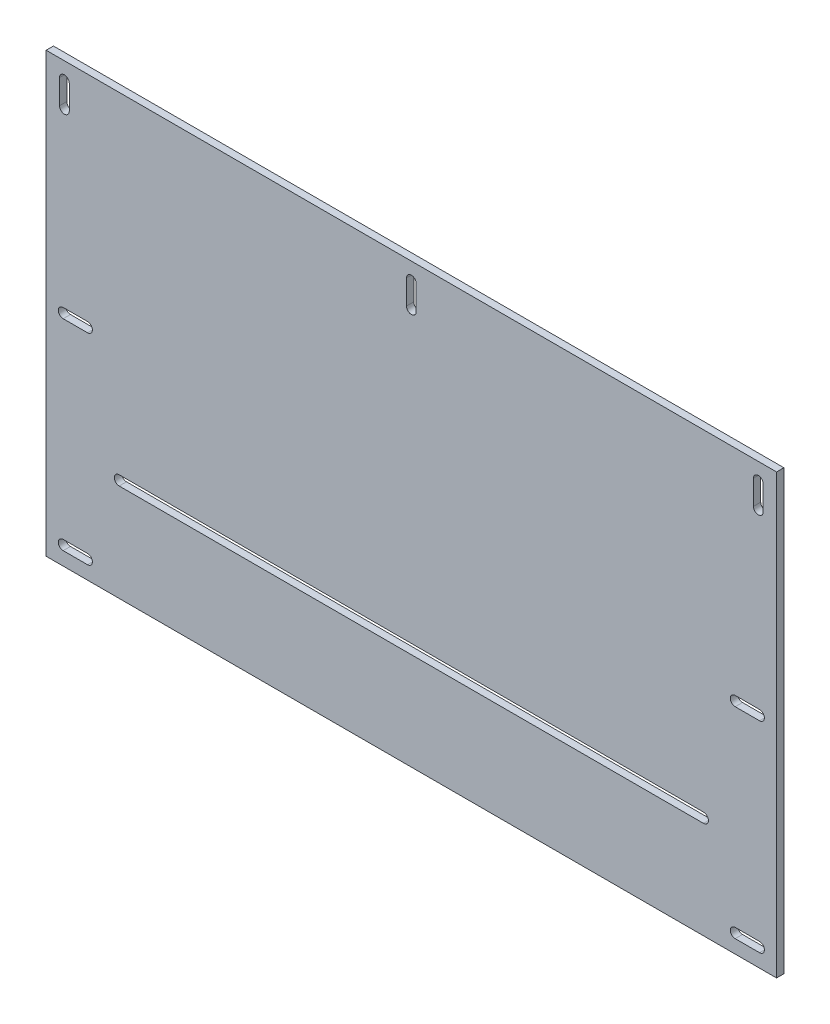
from build123d import *

# Parameters (mm, degrees)
SKETCH3_W           = 300
SKETCH3_H           = 180
BOSS_EXTRUDE2_DEPTH = 3
CUT_EXTRUDE1_DEPTH  = 3
CUT_EXTRUDE2_DEPTH  = 3
CUT_EXTRUDE3_DEPTH  = 10
CUT_EXTRUDE4_DEPTH  = 10
CUT_EXTRUDE5_DEPTH  = 10


with BuildPart() as part:
    # Sketch3 → Boss-Extrude2 (new body)
    with BuildSketch(Plane.XY):
        Rectangle(SKETCH3_W, SKETCH3_H)
    extrude(amount=BOSS_EXTRUDE2_DEPTH)

    # Sketch4 → Cut-Extrude1 (cut)
    with BuildSketch(Plane.XY.offset(3)):
        with BuildLine():
            Line((-140.5, 83), (-140.5, 73))
            ThreePointArc((-140.5, 73), (-142.5, 71), (-144.5, 73))
            Line((-144.5, 73), (-144.5, 83))
            ThreePointArc((-144.5, 83), (-142.5, 85), (-140.5, 83))
        make_face()
        with BuildLine():
            Line((2, 83), (2, 73))
            ThreePointArc((2, 73), (0, 71), (-2, 73))
            Line((-2, 73), (-2, 83))
            ThreePointArc((-2, 83), (0, 85), (2, 83))
        make_face()
        with BuildLine():
            Line((144.5, 83), (144.5, 73))
            ThreePointArc((144.5, 73), (142.5, 71), (140.5, 73))
            Line((140.5, 73), (140.5, 83))
            ThreePointArc((140.5, 83), (142.5, 85), (144.5, 83))
        make_face()
    extrude(amount=-CUT_EXTRUDE1_DEPTH, mode=Mode.SUBTRACT)

    # Sketch5 → Cut-Extrude2 (cut)
    with BuildSketch(Plane.XY.offset(3)):
        with BuildLine():
            Line((-143, 2), (-133, 2))
            ThreePointArc((-133, 2), (-131, 0), (-133, -2))
            Line((-133, -2), (-143, -2))
            ThreePointArc((-143, -2), (-145, 0), (-143, 2))
        make_face()
        with BuildLine():
            Line((133, 2), (143, 2))
            ThreePointArc((143, 2), (145, 0), (143, -2))
            Line((143, -2), (133, -2))
            ThreePointArc((133, -2), (131, 0), (133, 2))
        make_face()
    extrude(amount=-CUT_EXTRUDE2_DEPTH, mode=Mode.SUBTRACT)

    # Sketch6 → Cut-Extrude3 (cut)
    with BuildSketch(Plane.XY.offset(3)):
        with BuildLine():
            Line((143, -84.5), (133, -84.5))
            ThreePointArc((133, -84.5), (131, -82.5), (133, -80.5))
            Line((133, -80.5), (143, -80.5))
            ThreePointArc((143, -80.5), (145, -82.5), (143, -84.5))
        make_face()
    extrude(amount=-CUT_EXTRUDE3_DEPTH, mode=Mode.SUBTRACT)

    # Sketch7 → Cut-Extrude4 (cut)
    with BuildSketch(Plane.XY.offset(3)):
        with BuildLine():
            Line((-143, -80.5), (-133, -80.5))
            ThreePointArc((-133, -80.5), (-131, -82.5), (-133, -84.5))
            Line((-133, -84.5), (-143, -84.5))
            ThreePointArc((-143, -84.5), (-145, -82.5), (-143, -80.5))
        make_face()
    extrude(amount=-CUT_EXTRUDE4_DEPTH, mode=Mode.SUBTRACT)

    # Sketch8 → Cut-Extrude5 (cut)
    with BuildSketch(Plane.XY.offset(3)):
        with BuildLine():
            Line((-120, -46), (120, -46))
            ThreePointArc((120, -46), (122, -48), (120, -50))
            Line((120, -50), (-120, -50))
            ThreePointArc((-120, -50), (-122, -48), (-120, -46))
        make_face()
    extrude(amount=-CUT_EXTRUDE5_DEPTH, mode=Mode.SUBTRACT)


solid = part.part
